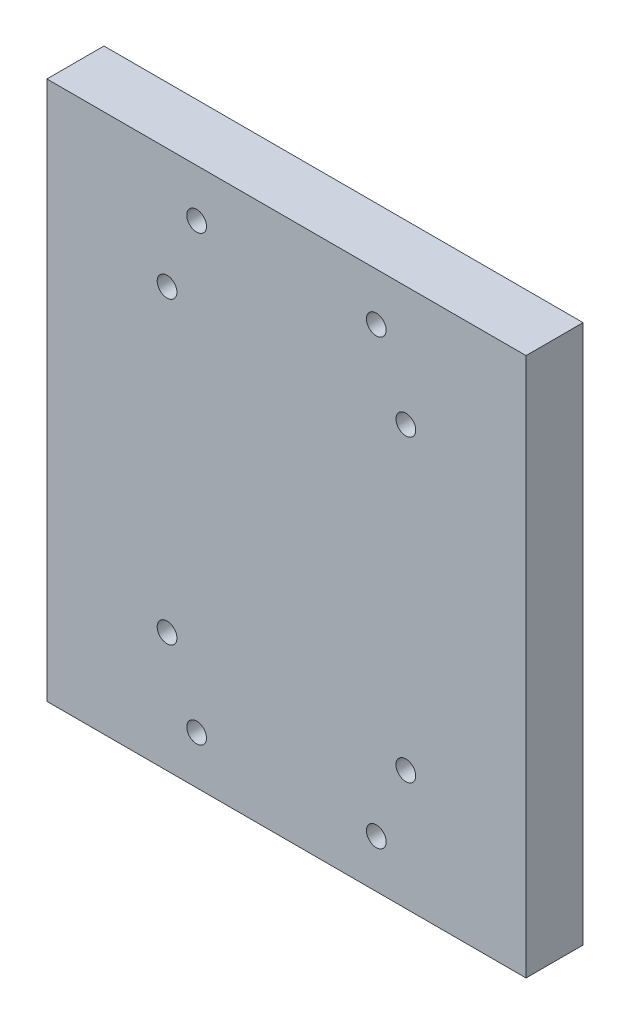
from build123d import *

# Parameters (mm, degrees)
SKETCH1_W                 = 80
SKETCH1_H                 = 90
SKETCH1_R                 = 1.65
BOSS_EXTRUDE1_DEPTH       = 9.53
M4X0_7_TAPPED_HOLE1_D     = 3.3
M4X0_7_TAPPED_HOLE1_DEPTH = 10.1
M4X0_7_TAPPED_HOLE1_TIP   = 0.991420021


with BuildPart() as part:
    # Sketch1 → Boss-Extrude1 (new body)
    with BuildSketch(Plane.XY):
        with Locations((40, 45)):
            Rectangle(SKETCH1_W, SKETCH1_H)
        with Locations((55, 8)):
            Circle(SKETCH1_R, mode=Mode.SUBTRACT)
        with Locations((25, 8)):
            Circle(SKETCH1_R, mode=Mode.SUBTRACT)
        with Locations((55, 82)):
            Circle(SKETCH1_R, mode=Mode.SUBTRACT)
        with Locations((25, 82)):
            Circle(SKETCH1_R, mode=Mode.SUBTRACT)
    extrude(amount=BOSS_EXTRUDE1_DEPTH)

    # M4x0.7 Tapped Hole1
    with Locations(Plane(origin=(20.065, 70, 9.53), x_dir=(1, 0, 0), z_dir=(0, 0, 1))):
        with Locations((0, 0), (0, -50), (39.87, -50), (39.87, 0)):
            Hole(M4X0_7_TAPPED_HOLE1_D / 2, depth=M4X0_7_TAPPED_HOLE1_DEPTH)
            with Locations((0, 0, -(M4X0_7_TAPPED_HOLE1_DEPTH + M4X0_7_TAPPED_HOLE1_TIP / 2))):  # 118° drill point
                Cone(0, M4X0_7_TAPPED_HOLE1_D / 2, M4X0_7_TAPPED_HOLE1_TIP, mode=Mode.SUBTRACT)


solid = part.part
